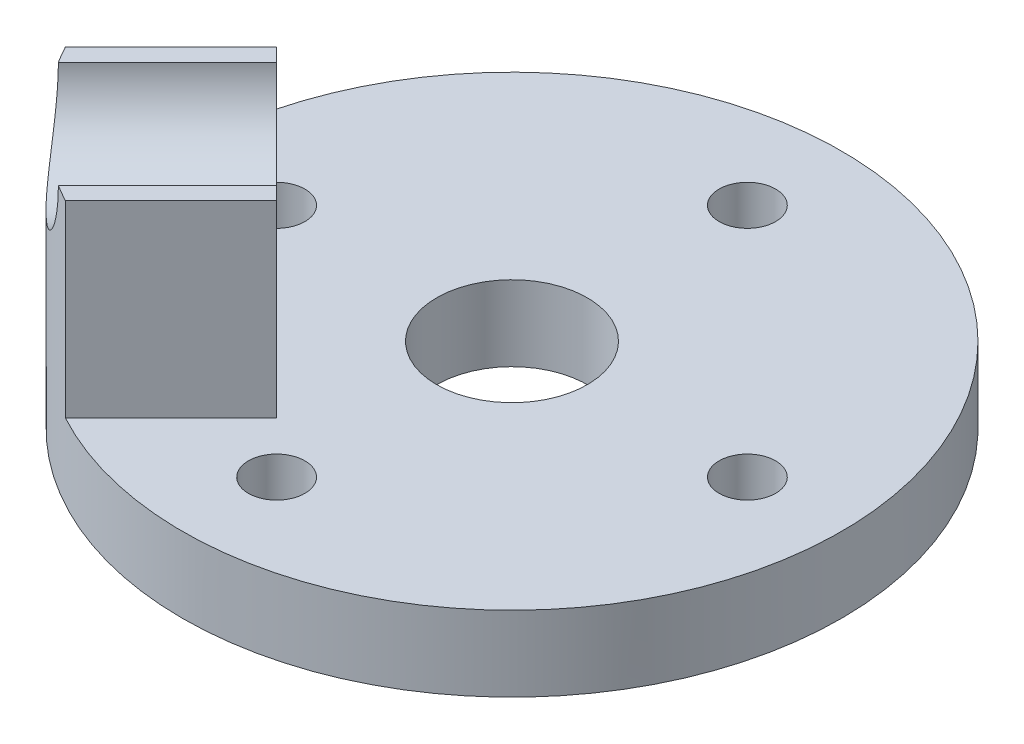
from build123d import *

# Parameters (mm, degrees)
SKETCH1_R           = 17.5
SKETCH1_R_2         = 4
SKETCH1_R_3         = 1.5
BOSS_EXTRUDE1_DEPTH = 4
BOSS_EXTRUDE2_DEPTH = 10
SKETCH3_R           = 4
CUT_EXTRUDE1_DEPTH  = 10


with BuildPart() as part:
    # Sketch1 → Boss-Extrude1 (new body)
    with BuildSketch(Plane(origin=(0, 0, 0), x_dir=(1, 0, 0), z_dir=(0, 1, 0))):
        with Locations(Location((0, 0, 0), (0, 0, 270))):
            Circle(SKETCH1_R)
        with Locations(Location((0, 0, 0), (0, 0, 270))):
            Circle(SKETCH1_R_2, mode=Mode.SUBTRACT)
        with Locations(Location((-12.5, 0, 0), (0, 0, 270))):
            Circle(SKETCH1_R_3, mode=Mode.SUBTRACT)
        with Locations(Location((0, 12.5, 0), (0, 0, 270))):
            Circle(SKETCH1_R_3, mode=Mode.SUBTRACT)
        with Locations(Location((12.5, 0, 0), (0, 0, 270))):
            Circle(SKETCH1_R_3, mode=Mode.SUBTRACT)
        with Locations(Location((0, -12.5, 0), (0, 0, 270))):
            Circle(SKETCH1_R_3, mode=Mode.SUBTRACT)
    extrude(amount=BOSS_EXTRUDE1_DEPTH)

    # Sketch2 → Boss-Extrude2 (add)
    with BuildSketch(Plane(origin=(0, 4, 0), x_dir=(1, 0, 0), z_dir=(0, 1, 0))):
        with BuildLine():
            Line((-6.25, -6.25), (-9.785533906, -2.714466094))
            Line((-9.785533906, -2.714466094), (-15.394075132, -8.32300732))
            ThreePointArc((-15.394075132, -8.32300732), (-12.374368671, -12.374368671), (-8.32300732, -15.394075132))
            Line((-8.32300732, -15.394075132), (-2.714466094, -9.785533906))
            Line((-2.714466094, -9.785533906), (-6.25, -6.25))
        make_face()
    extrude(amount=BOSS_EXTRUDE2_DEPTH)

    # Sketch3 → Cut-Extrude1 (cut)
    with BuildSketch(Plane(origin=(-6.25, 0, 6.25), x_dir=(-0.7071067811865475, 0, -0.7071067811865477), z_dir=(0.7071067811865477, 0, -0.7071067811865475))):
        with Locations((0, 14)):
            Circle(SKETCH3_R)
    extrude(amount=-CUT_EXTRUDE1_DEPTH, mode=Mode.SUBTRACT)


solid = part.part
